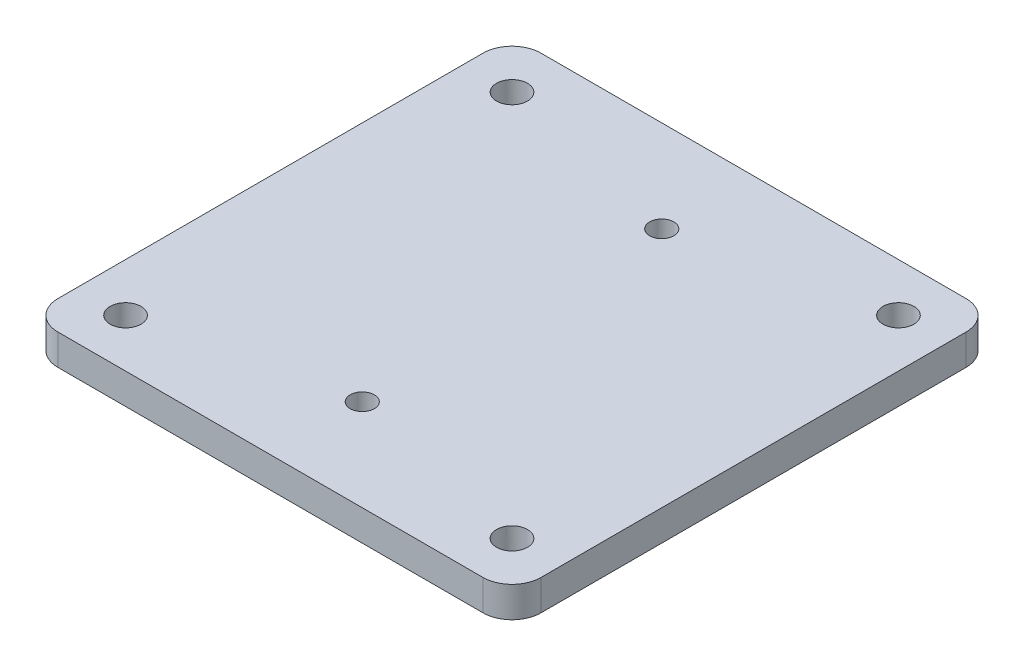
from build123d import *

# Parameters (mm, degrees)
SKETCH1_W                = 50
SKETCH1_H                = 50
BOSS_EXTRUDE1_DEPTH      = 3.175
M3_CLEARANCE_HOLE1_D     = 3.2
M3_CLEARANCE_HOLE1_DEPTH = 12.4
M3_CLEARANCE_HOLE1_TIP   = 0.96137699
M3X0_5_TAPPED_HOLE1_D    = 2.5
FILLET1_R                = 3


with BuildPart() as part:
    # Sketch1 → Boss-Extrude1 (new body)
    with BuildSketch(Plane(origin=(0, 0, 0), x_dir=(1, 0, 0), z_dir=(0, 1, 0))):
        Rectangle(SKETCH1_W, SKETCH1_H)
    extrude(amount=BOSS_EXTRUDE1_DEPTH)

    # M3 Clearance Hole1
    with Locations(Plane(origin=(0, 3.175, 0), x_dir=(1, 0, 0), z_dir=(0, 1, 0))):
        with Locations((-20, 20), (20, 20), (-20, -20), (20, -20)):
            Hole(M3_CLEARANCE_HOLE1_D / 2, depth=M3_CLEARANCE_HOLE1_DEPTH)
            with Locations((0, 0, -(M3_CLEARANCE_HOLE1_DEPTH + M3_CLEARANCE_HOLE1_TIP / 2))):  # 118° drill point
                Cone(0, M3_CLEARANCE_HOLE1_D / 2, M3_CLEARANCE_HOLE1_TIP, mode=Mode.SUBTRACT)

    # M3x0.5 Tapped Hole1 (through all)
    with Locations(Plane(origin=(0, 3.175, 0), x_dir=(1, 0, 0), z_dir=(0, 1, 0))):
        with Locations((0, 15.5), (0, -15.5)):
            Hole(M3X0_5_TAPPED_HOLE1_D / 2)

    # Fillet1
    fillet1_edges = [part.edges().sort_by_distance(p)[0] for p in [
        (25, 1.5875, 25),
        (-25, 1.5875, 25),
        (-25, 1.5875, -25),
        (25, 1.5875, -25),
    ]]
    fillet(fillet1_edges, radius=FILLET1_R)


solid = part.part
